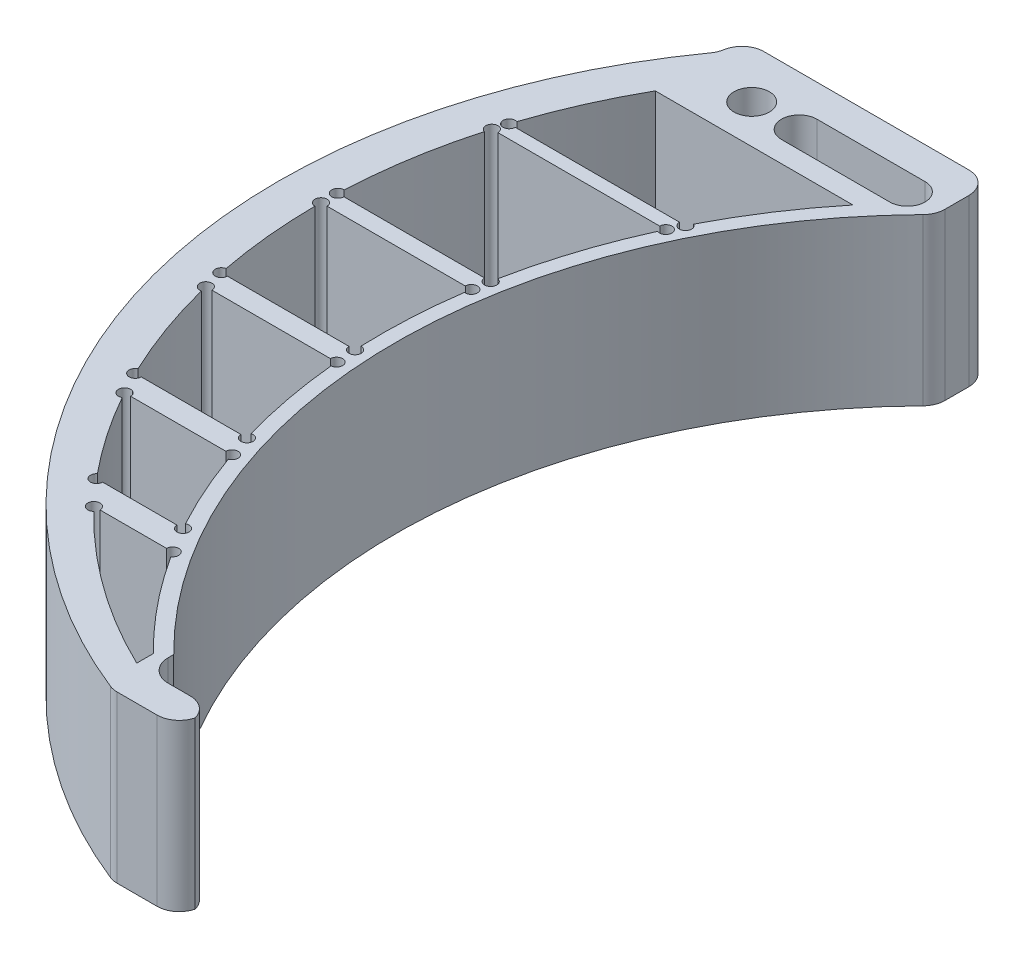
from build123d import *

# Parameters (mm, degrees)
ESQUISSE1_R        = 1.6
BOSS_EXTRU_1_DEPTH = 15


with BuildPart() as part:
    # Esquisse1 → Boss.-Extru.1 (new body)
    with BuildSketch(Plane(origin=(0, 0, 0), x_dir=(1, 0, 0), z_dir=(0, 1, 0))):
        with BuildLine():
            Line((0.379867182, -77.5), (4, -77.5))
            ThreePointArc((4, -77.5), (5.224744871, -77.08113883), (5.936491673, -76))
            ThreePointArc((5.936491673, -76), (5.224744871, -74.91886117), (4, -74.5))
            Line((4, -74.5), (2, -74.5))
            ThreePointArc((2, -74.5), (0.585786438, -73.914213562), (0, -72.5))
            Line((0, -72.5), (0, -72))
            ThreePointArc((0, -72), (-14.427005158, -37.9049997), (-0.571883425, -3.573627385))
            ThreePointArc((-0.571883425, -3.573627385), (-0.148482629, -2.929684622), (0, -2.173454879))
            Line((0, -2.173454879), (0, 0))
            ThreePointArc((0, 0), (-0.585786438, 1.414213562), (-2, 2))
            Line((-2, 2), (-20.553034366, 2))
            ThreePointArc((-20.553034366, 2), (-21.847406556, 1.524664105), (-22.526517183, 0.324600632))
            ThreePointArc((-22.526517183, 0.324600632), (-22.651920818, -0.115392313), (-22.874034374, -0.515374102))
            ThreePointArc((-22.874034374, -0.515374102), (-30.332217892, -44.419762154), (-0.360571251, -77.357888836))
            ThreePointArc((-0.360571251, -77.357888836), (0.002890838, -77.46415092), (0.379867182, -77.5))
        make_face()
        with Locations(Location((-17.168486885, -2.5, 0), (0, 0, 90))):
            Circle(ESQUISSE1_R, mode=Mode.SUBTRACT)
        with BuildLine():
            Line((-26.245903328, -16.4), (-11.593054617, -16.4))
            ThreePointArc((-11.593054617, -16.4), (-10.579787815, -16.103547862), (-11.273476907, -16.899405215))
            ThreePointArc((-11.273476907, -16.899405215), (-13.352037133, -22.277466593), (-14.794641856, -27.85983602))
            ThreePointArc((-14.794641856, -27.85983602), (-14.547802836, -28.823941756), (-15.448193173, -28.4))
            Line((-15.448193173, -28.4), (-28.185804557, -28.4))
            ThreePointArc((-28.185804557, -28.4), (-29.132721919, -28.780731674), (-28.712919494, -27.850476321))
            ThreePointArc((-28.712919494, -27.850476321), (-28.139109588, -22.339660076), (-26.947329323, -16.928743953))
            ThreePointArc((-26.947329323, -16.928743953), (-27.126974093, -15.960805113), (-26.245903328, -16.4))
        make_face(mode=Mode.SUBTRACT)
        with BuildLine():
            Line((-28.216882659, -29.9), (-15.703506193, -29.9))
            ThreePointArc((-15.703506193, -29.9), (-14.736948258, -29.540862859), (-15.234489879, -30.444005186))
            ThreePointArc((-15.234489879, -30.444005186), (-15.668556704, -34.886741932), (-15.702797946, -39.350501707))
            ThreePointArc((-15.702797946, -39.350501707), (-15.282185488, -40.280514324), (-16.229311222, -39.9))
            Line((-16.229311222, -39.9), (-27.241766652, -39.9))
            ThreePointArc((-27.241766652, -39.9), (-28.141135688, -40.3247838), (-27.897916749, -39.360340703))
            ThreePointArc((-27.897916749, -39.360340703), (-28.536105971, -34.925039157), (-28.766778335, -30.44999999))
            ThreePointArc((-28.766778335, -30.44999999), (-29.155828271, -29.511128156), (-28.216882659, -29.9))
        make_face(mode=Mode.SUBTRACT)
        with BuildLine():
            Line((-14.218448274, -51.7), (-23.236538966, -51.7))
            ThreePointArc((-23.236538966, -51.7), (-24.079106647, -52.165729699), (-24.025281338, -51.204518335))
            ThreePointArc((-24.025281338, -51.204518335), (-25.860949004, -46.797976835), (-27.259486048, -42.233836401))
            ThreePointArc((-27.259486048, -42.233836401), (-27.825028416, -41.361102537), (-26.841844264, -41.7))
            Line((-26.841844264, -41.7), (-16.109676342, -41.7))
            ThreePointArc((-16.109676342, -41.7), (-15.188659613, -41.293986962), (-15.510234208, -42.247773197))
            ThreePointArc((-15.510234208, -42.247773197), (-14.870347536, -46.748469382), (-13.822458806, -51.172003072))
            ThreePointArc((-13.822458806, -51.172003072), (-13.228444983, -52.029995612), (-14.218448274, -51.7))
        make_face(mode=Mode.SUBTRACT)
        with BuildLine():
            Line((-22.201450768, -53.7), (-13.576816642, -53.7))
            ThreePointArc((-13.576816642, -53.7), (-12.708653375, -53.251366369), (-12.844917969, -54.219049971))
            ThreePointArc((-12.844917969, -54.219049971), (-11.418475339, -57.778687264), (-9.722191927, -61.217928288))
            ThreePointArc((-9.722191927, -61.217928288), (-8.984061268, -61.980064854), (-10.007414918, -61.7))
            Line((-10.007414918, -61.7), (-16.734180973, -61.7))
            ThreePointArc((-16.734180973, -61.7), (-17.517935865, -62.197854045), (-17.635485157, -61.276815206))
            ThreePointArc((-17.635485157, -61.276815206), (-20.215891111, -57.835366348), (-22.484800972, -54.181038342))
            ThreePointArc((-22.484800972, -54.181038342), (-23.225348113, -53.420856119), (-22.201450768, -53.7))
        make_face(mode=Mode.SUBTRACT)
        with BuildLine():
            Line((-14.676144728, -64), (-8.645402719, -64))
            ThreePointArc((-8.645402719, -64), (-7.830810759, -63.517826697), (-7.799980557, -64.463924289))
            ThreePointArc((-7.799980557, -64.463924289), (-4.628127789, -68.842617177), (-1, -72.851393816))
            Line((-1, -72.851393816), (-1, -74.351393816))
            ThreePointArc((-1, -74.351393816), (-8.358263561, -69.980068178), (-14.84445078, -64.395992083))
            ThreePointArc((-14.84445078, -64.395992083), (-15.7323224, -63.784862453), (-14.676144728, -64))
        make_face(mode=Mode.SUBTRACT)
        with BuildLine():
            Line((-3.068400716, -4.1), (-12.868400716, -4.1))
            ThreePointArc((-12.868400716, -4.1), (-14.468400716, -2.5), (-12.868400716, -0.9))
            Line((-12.868400716, -0.9), (-3.068400716, -0.9))
            ThreePointArc((-3.068400716, -0.9), (-1.468400716, -2.5), (-3.068400716, -4.1))
        make_face(mode=Mode.SUBTRACT)
        with BuildLine():
            Line((-11.011595694, -15.2), (-25.878211235, -15.2))
            ThreePointArc((-25.878211235, -15.2), (-26.873424632, -15.52293193), (-26.257429531, -14.677186831))
            ThreePointArc((-26.257429531, -14.677186831), (-24.539239864, -10.245004819), (-22.4, -6))
            Line((-22.4, -6), (-4.5, -6))
            ThreePointArc((-4.5, -6), (-7.584699304, -10.204982732), (-10.212442966, -14.709670602))
            ThreePointArc((-10.212442966, -14.709670602), (-10.173962247, -15.668793132), (-11.011595694, -15.2))
        make_face(mode=Mode.SUBTRACT)
    extrude(amount=-BOSS_EXTRU_1_DEPTH)


solid = part.part
